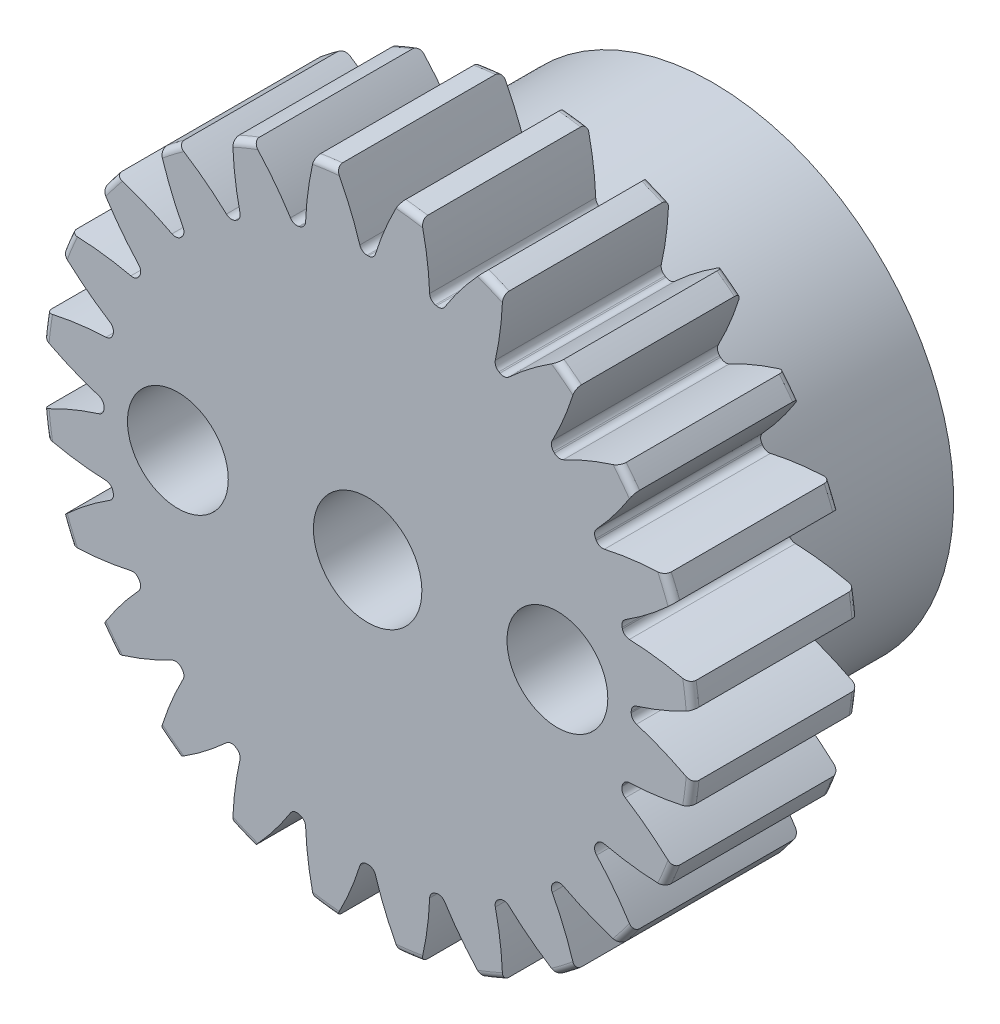
from build123d import *

# Parameters (mm, degrees)
FILLET2_R               = 0.2751582
CUT_EXTRUDE2_DEPTH      = 21.677528365
CIRPATTERN1_COUNT       = 24
SKETCH8_R               = 10.16
BOSS_EXTRUDE1_DEPTH     = 2.54
SKETCH14_R              = 10.16
BOSS_EXTRUDE2_DEPTH     = 5.0038
CUT_EXTRUDE3_START      = 5.0038
SKETCH11_R              = 4.064
CUT_EXTRUDE3_DEPTH      = 1.27
CUT_EXTRUDE4_DEPTH      = 11.43
CUT_EXTRUDE4_DEPTH_BACK = 21.59
SKETCH9_R               = 1.27
CUT_EXTRUDE5_DEPTH      = 21.59
CUT_EXTRUDE5_DEPTH_BACK = 21.59
SKETCH12_R              = 1.016
SKETCH10_R              = 2.286
CUT_EXTRUDE6_DEPTH      = 12.0038
SKETCH13_R              = 2.125
CUT_EXTRUDE7_DEPTH      = 13.2738


with BuildPart() as part:
    # Sketch4 → Revolve1 (revolve)
    with BuildSketch(Plane(origin=(0, 0, 0), x_dir=(0, 0, -1), z_dir=(1, 0, 0))):
        Polygon((-7, 3.175), (-7, 0), (0, 0), (0, 3.175), (0, 13.75791), (-7, 13.75791), align=None)
    revolve(axis=Axis((0, 0, 7), (0, 0, 1)))

    # Fillet2
    fillet2_edges = [part.edges().sort_by_distance(p)[0] for p in [
        (0, -13.75791, 0),
        (0, -13.75791, 7),
    ]]
    fillet(fillet2_edges, radius=FILLET2_R)

    # Sketch7 → Cut-Extrude2 (cut, through all)
    with BuildSketch(Plane.XY.offset(7)):
        with BuildLine():
            ThreePointArc((-0.025888514, 11.11204651), (0, 11.112076667), (0.025888514, 11.11204651))
            ThreePointArc((0.025888514, 11.11204651), (0.214525602, 11.173608764), (0.329782653, 11.335131749))
            ThreePointArc((0.329782653, 11.335131749), (0.772860919, 12.539479189), (1.335214608, 13.692964965))
            ThreePointArc((1.335214608, 13.692964965), (0, 13.75791), (-1.335214608, 13.692964965))
            ThreePointArc((-1.335214608, 13.692964965), (-0.772860919, 12.539479189), (-0.329782653, 11.335131749))
            ThreePointArc((-0.329782653, 11.335131749), (-0.214525602, 11.173608764), (-0.025888514, 11.11204651))
        make_face()
    cut_extrude2 = extrude(amount=-CUT_EXTRUDE2_DEPTH, mode=Mode.SUBTRACT)

    # CirPattern1: Cut-Extrude2 ×24 about axis
    cirpattern1_axis = Axis((0, 0, 0), (0, 0, 1))
    for i in range(1, CIRPATTERN1_COUNT):
        add(cut_extrude2.rotate(cirpattern1_axis, i * 360 / CIRPATTERN1_COUNT), mode=Mode.SUBTRACT)

    # Sketch8 → Boss-Extrude1 (add)
    with BuildSketch(Plane(origin=(0, 0, 0), x_dir=(-1, 0, 0), z_dir=(0, 0, -1))):
        with Locations(Location((0, 0, 0), (0, 0, 90))):
            Circle(SKETCH8_R)
    extrude(amount=BOSS_EXTRUDE1_DEPTH)

    # Sketch14 → Boss-Extrude2 (add)
    with BuildSketch(Plane(origin=(0, 0, -2.54), x_dir=(-1, 0, 0), z_dir=(0, 0, -1))):
        with Locations(Location((0, 0, 0), (0, 0, 90))):
            Circle(SKETCH14_R)
    extrude(amount=BOSS_EXTRUDE2_DEPTH)

    # Sketch11 → Cut-Extrude3 (cut)
    with BuildSketch(Plane(origin=(0, 0, -2.54), x_dir=(-1, 0, 0), z_dir=(0, 0, -1)).offset(CUT_EXTRUDE3_START)):
        with Locations(Location((0, 0, 0), (0, 0, 90))):
            Circle(SKETCH11_R)
    extrude(amount=-CUT_EXTRUDE3_DEPTH, mode=Mode.SUBTRACT)

    # Sketch9 → Cut-Extrude4 (cut, two sides: drawn at the far end of the back side and taken through both)
    with BuildSketch(Plane.XY.offset(7).offset(-CUT_EXTRUDE4_DEPTH_BACK)):
        with Locations(Location((0, 0, 0), (0, 0, 180))):
            Circle(SKETCH9_R)
    extrude(amount=CUT_EXTRUDE4_DEPTH + CUT_EXTRUDE4_DEPTH_BACK, mode=Mode.SUBTRACT)

    # Sketch12 → Cut-Extrude5 (cut, two sides: drawn at the far end of the back side and taken through both)
    with BuildSketch(Plane.XY.offset(7).offset(-CUT_EXTRUDE5_DEPTH_BACK)):
        with Locations(Location((-8, 0, 0), (0, 0, 90))):
            Circle(SKETCH12_R)
        with Locations(Location((8, 0, 0), (0, 0, 90))):
            Circle(SKETCH12_R)
    extrude(amount=CUT_EXTRUDE5_DEPTH + CUT_EXTRUDE5_DEPTH_BACK, mode=Mode.SUBTRACT)

    # Sketch10 → Cut-Extrude6 (cut)
    with BuildSketch(Plane.XY.offset(7)):
        with Locations(Location((0, 0, 0), (0, 0, 270))):
            Circle(SKETCH10_R)
    extrude(amount=-CUT_EXTRUDE6_DEPTH, mode=Mode.SUBTRACT)

    # Sketch13 → Cut-Extrude7 (cut)
    with BuildSketch(Plane.XY.offset(7)):
        with Locations((-8, 0)):
            Circle(SKETCH13_R)
        with Locations((8, 0)):
            Circle(SKETCH13_R)
    extrude(amount=-CUT_EXTRUDE7_DEPTH, mode=Mode.SUBTRACT)


solid = part.part
